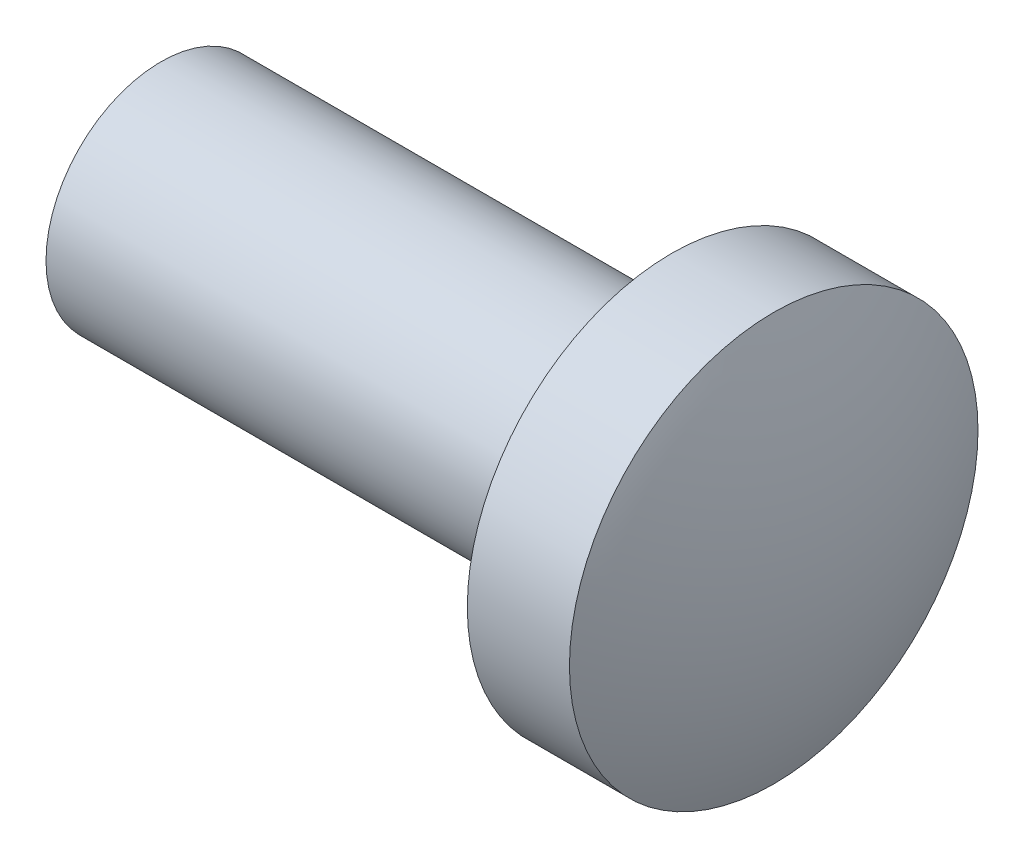
from build123d import *

# Parameters (mm, degrees)
SKETCH2_R          = 1.25
CUT_EXTRUDE1_DEPTH = 11.25
SKETCH3_R          = 1.7
CUT_EXTRUDE2_DEPTH = 0.35


with BuildPart() as part:
    # Sketch1 → Revolve1 (revolve)
    with BuildSketch(Plane.XY, mode=Mode.PRIVATE) as revolve1_sk:
        with BuildLine():
            Line((0, 0), (0, 2.25))
            Line((0, 2.25), (10, 2.25))
            Line((10, 2.25), (10, 4))
            Line((10, 4), (12, 4))
            ThreePointArc((12, 4), (12.635153756, 2.044657673), (12.85, 0))
            Line((12.85, 0), (0, 0))
        make_face()
    revolve(revolve1_sk.sketch.rotate(Axis((0, 0, 0), (1, 0, 0)), 90), axis=Axis((0, 0, 0), (1, 0, 0)))

    # Sketch2 → Cut-Extrude1 (cut)
    with BuildSketch(Plane.ZY):
        Circle(SKETCH2_R)
    extrude(amount=-CUT_EXTRUDE1_DEPTH, mode=Mode.SUBTRACT)

    # Sketch3 → Cut-Extrude2 (cut)
    with BuildSketch(Plane.ZY.offset(-11.25)):
        Circle(SKETCH3_R)
    extrude(amount=-CUT_EXTRUDE2_DEPTH, mode=Mode.SUBTRACT)


solid = part.part
